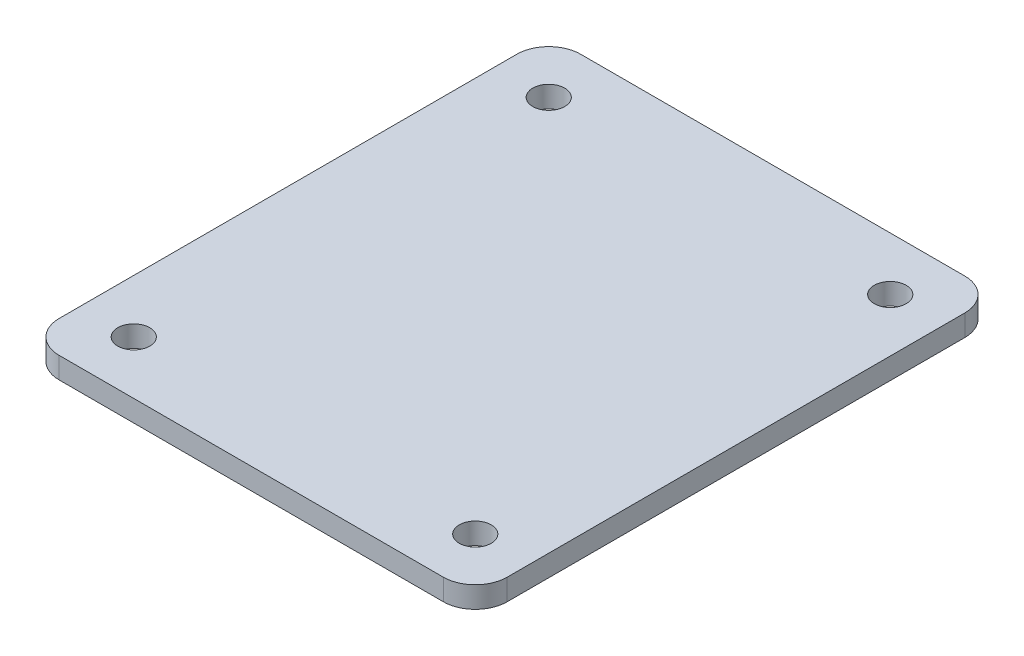
from build123d import *

# Parameters (mm, degrees)
SKETCH_1_W          = 42.03879434
SKETCH_1_H          = 48.933205412
EXTRUDE_1_DEPTH     = 2
SKETCH_3_R          = 1.5
CUT_EXTRUDE_1_DEPTH = 33.317637682
FILLET_1_R          = 3


with BuildPart() as part:
    # Эскиз1 → Бобышка-Вытянуть1 (new body)
    with BuildSketch(Plane(origin=(0, 0, 0), x_dir=(1, 0, 0), z_dir=(0, 1, 0))):
        Rectangle(SKETCH_1_W, SKETCH_1_H)
    extrude(amount=EXTRUDE_1_DEPTH)

    # Эскиз3 → Вырез-Вытянуть1 (cut, through all)
    with BuildSketch(Plane(origin=(0, 2, 0), x_dir=(1, 0, 0), z_dir=(0, 1, 0))):
        with Locations(Location((-16.01939717, 19.466602706, 0), (0, 0, 270))):
            Circle(SKETCH_3_R)
        with Locations(Location((16.01939717, 19.466602706, 0), (0, 0, 270))):
            Circle(SKETCH_3_R)
        with Locations(Location((16.01939717, -19.466602706, 0), (0, 0, 270))):
            Circle(SKETCH_3_R)
        with Locations(Location((-16.01939717, -19.466602706, 0), (0, 0, 270))):
            Circle(SKETCH_3_R)
    extrude(amount=-CUT_EXTRUDE_1_DEPTH, mode=Mode.SUBTRACT)

    # Скругление1
    fillet_1_edges = [part.edges().sort_by_distance(p)[0] for p in [
        (21.01939717, 1, 24.466602706),
        (-21.01939717, 1, 24.466602706),
        (-21.01939717, 1, -24.466602706),
        (21.01939717, 1, -24.466602706),
    ]]
    fillet(fillet_1_edges, radius=FILLET_1_R)


solid = part.part
